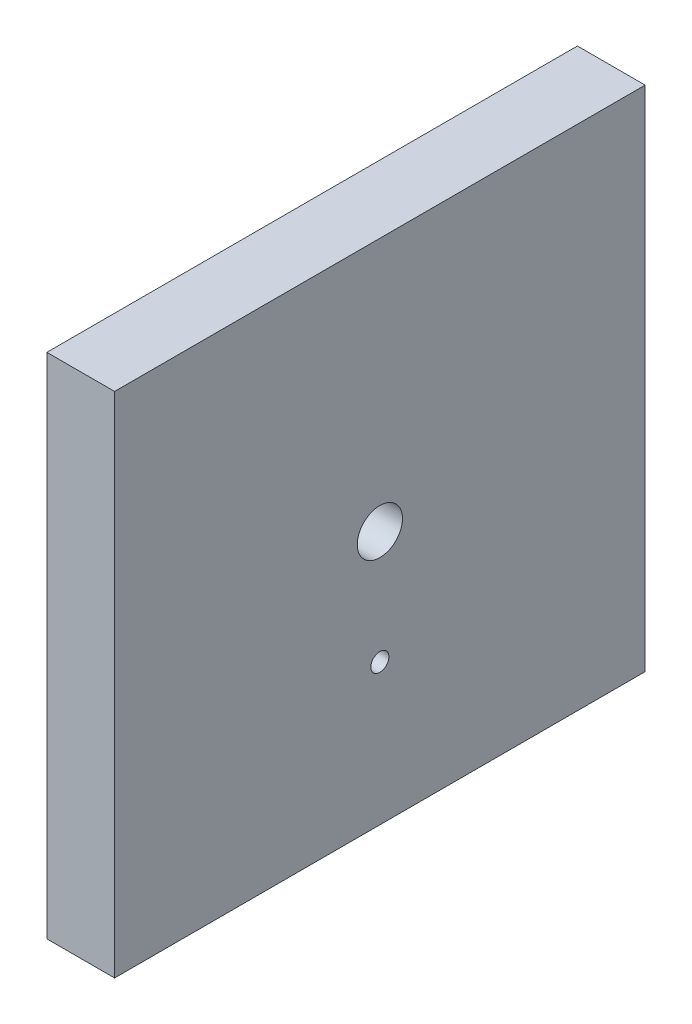
from build123d import *

# Parameters (mm, degrees)
SKETCH1_W           = 94
SKETCH1_H           = 90
BOSS_EXTRUDE1_DEPTH = 12
SKETCH2_R           = 4
CUT_EXTRUDE1_DEPTH  = 67.166456759
SKETCH3_R           = 1.6
CUT_EXTRUDE2_DEPTH  = 67.166456759


with BuildPart() as part:
    # Sketch1 → Boss-Extrude1 (new body)
    with BuildSketch(Plane(origin=(0, 0, 0), x_dir=(0, 0, -1), z_dir=(1, 0, 0))):
        Rectangle(SKETCH1_W, SKETCH1_H)
    extrude(amount=BOSS_EXTRUDE1_DEPTH)

    # Sketch2 → Cut-Extrude1 (cut, through all)
    with BuildSketch(Plane(origin=(12, 0, 0), x_dir=(0, 0, -1), z_dir=(1, 0, 0))):
        Circle(SKETCH2_R)
    extrude(amount=-CUT_EXTRUDE1_DEPTH, mode=Mode.SUBTRACT)

    # Sketch3 → Cut-Extrude2 (cut, through all)
    with BuildSketch(Plane.ZY):
        with Locations((0, -20)):
            Circle(SKETCH3_R)
    extrude(amount=-CUT_EXTRUDE2_DEPTH, mode=Mode.SUBTRACT)


solid = part.part
